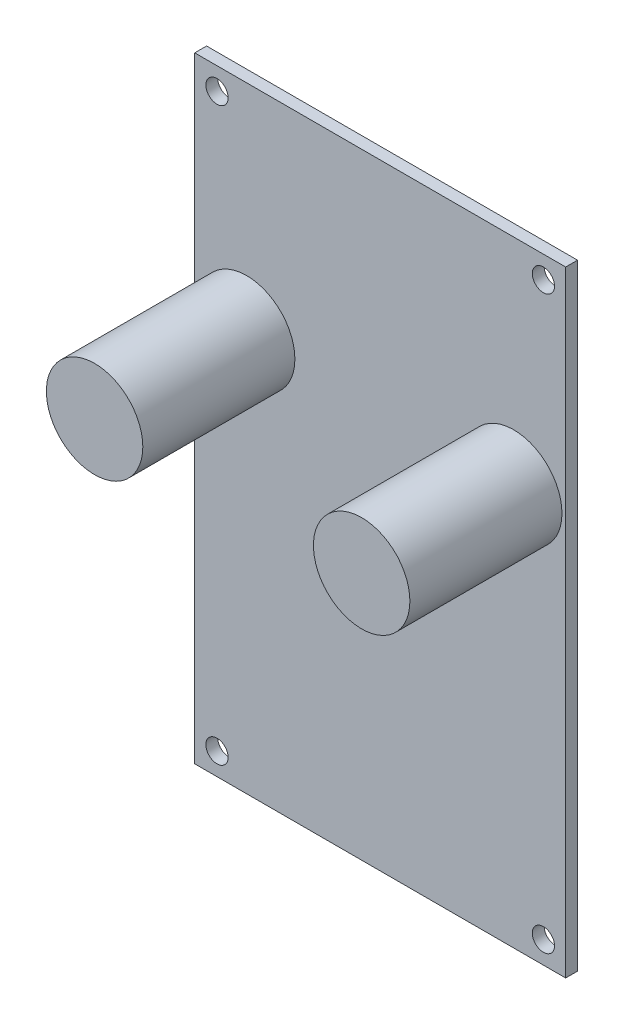
from build123d import *

# Parameters (mm, degrees)
ESQUISSE1_W        = 50
ESQUISSE1_H        = 83
ESQUISSE1_R        = 1.5
BOSS_EXTRU_1_DEPTH = 1.6
ESQUISSE2_R        = 6.5
BOSS_EXTRU_2_DEPTH = 20.5


with BuildPart() as part:
    # Esquisse1 → Boss.-Extru.1 (new body)
    with BuildSketch(Plane.XY):
        with Locations((25, -41.5)):
            Rectangle(ESQUISSE1_W, ESQUISSE1_H)
        with Locations((3, -3)):
            Circle(ESQUISSE1_R, mode=Mode.SUBTRACT)
        with Locations((47, -3)):
            Circle(ESQUISSE1_R, mode=Mode.SUBTRACT)
        with Locations((47, -80)):
            Circle(ESQUISSE1_R, mode=Mode.SUBTRACT)
        with Locations((3, -80)):
            Circle(ESQUISSE1_R, mode=Mode.SUBTRACT)
    extrude(amount=BOSS_EXTRU_1_DEPTH)

    # Esquisse2 → Boss.-Extru.2 (add)
    with BuildSketch(Plane.XY.offset(1.6)):
        with Locations((7, -29)):
            Circle(ESQUISSE2_R)
        with Locations((43, -29)):
            Circle(ESQUISSE2_R)
    extrude(amount=BOSS_EXTRU_2_DEPTH)


solid = part.part
